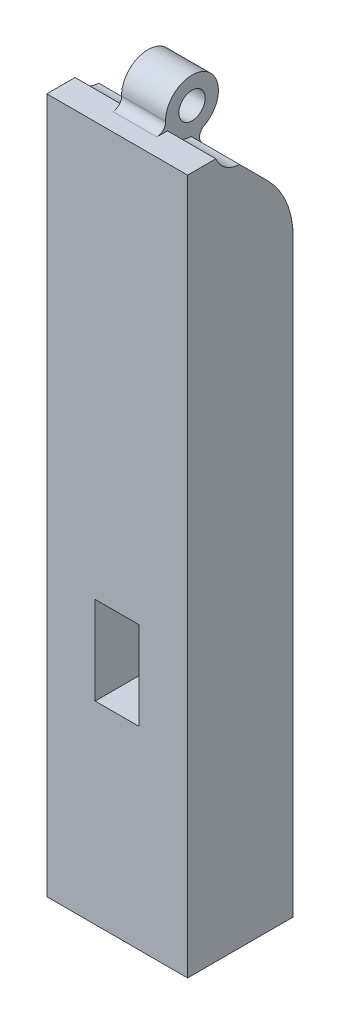
from build123d import *

# Parameters (mm, degrees)
SKETCH1_W               = 16
SKETCH1_H               = 79
BOSS_EXTRUDE1_DEPTH     = 12
CUT_EXTRUDE1_DEPTH      = 81.305666052
CUT_EXTRUDE1_DEPTH_BACK = 81.305666052
CUT_EXTRUDE2_DEPTH      = 81.305666052
CUT_EXTRUDE2_DEPTH_BACK = 81.305666052
SKETCH4_R               = 3
SKETCH4_R_2             = 1.5
BOSS_EXTRUDE2_DEPTH     = 2.5
FILLET1_R               = 1
FILLET2_R               = 10
SKETCH5_W               = 5
SKETCH5_H               = 10
CUT_EXTRUDE3_DEPTH      = 5
CUT_EXTRUDE4_REACH      = 55.096
SKETCH6_W               = 5
SKETCH6_H               = 2.5
SKETCH7_W               = 5
SKETCH7_H               = 10
CUT_EXTRUDE5_DEPTH      = 81.305666052


with BuildPart() as part:
    # Sketch1 → Boss-Extrude1 (new body)
    with BuildSketch(Plane.XY):
        with Locations((0, -39.5)):
            Rectangle(SKETCH1_W, SKETCH1_H)
    extrude(amount=BOSS_EXTRUDE1_DEPTH)

    # Sketch2 → Cut-Extrude1 (cut, two sides: drawn at the far end of the back side and taken through both)
    with BuildSketch(Plane(origin=(0, 0, 0), x_dir=(0, 0, -1), z_dir=(1, 0, 0)).offset(-CUT_EXTRUDE1_DEPTH_BACK)):
        Polygon((-8, 0), (0, 0), (0, -8), align=None)
    extrude(amount=CUT_EXTRUDE1_DEPTH + CUT_EXTRUDE1_DEPTH_BACK, mode=Mode.SUBTRACT)

    # Sketch3 → Cut-Extrude2 (cut, two sides: drawn at the far end of the back side and taken through both)
    with BuildSketch(Plane(origin=(0, 0, 0), x_dir=(0, 0, -1), z_dir=(1, 0, 0)).offset(-CUT_EXTRUDE2_DEPTH_BACK)):
        with BuildLine():
            ThreePointArc((-3, 1.1), (-6.559834153, 4.04730143), (-8.791057147, 0))
            Line((-8.791057147, 0), (-7.019803903, 0))
            ThreePointArc((-7.019803903, 0), (-6.600122548, 2.474719218), (-4.5, 1.1))
            ThreePointArc((-4.5, 1.1), (-4.625280782, 0.499877452), (-4.980196097, 0))
            Line((-4.980196097, 0), (-3.208942853, 0))
            ThreePointArc((-3.208942853, 0), (-3.05269857, 0.540165847), (-3, 1.1))
        make_face()
        with BuildLine():
            Line((-7.019803903, 0), (-8.791057147, 0))
            ThreePointArc((-8.791057147, 0), (-6, -1.9), (-3.208942853, 0))
            Line((-3.208942853, 0), (-4.980196097, 0))
            ThreePointArc((-4.980196097, 0), (-6, -0.4), (-7.019803903, 0))
        make_face()
    extrude(amount=CUT_EXTRUDE2_DEPTH + CUT_EXTRUDE2_DEPTH_BACK, mode=Mode.SUBTRACT)

    # Sketch4 → Boss-Extrude2 (add, symmetric)
    with BuildSketch(Plane(origin=(0, 0, 0), x_dir=(0, 0, -1), z_dir=(1, 0, 0))):
        with Locations((-6, 1.1)):
            Circle(SKETCH4_R)
        with Locations((-6, 1.1)):
            Circle(SKETCH4_R_2, mode=Mode.SUBTRACT)
    extrude(amount=BOSS_EXTRUDE2_DEPTH, both=True)

    # Fillet1
    fillet1_edges = [part.edges().sort_by_distance(p)[0] for p in [
        (0, -1.898274836, 6.101725164),
        (0, 0, 8.791057147),
    ]]
    fillet(fillet1_edges, radius=FILLET1_R)

    # Fillet2
    fillet2_edges = [part.edges().sort_by_distance(p)[0] for p in [
        (0, -8, 0),
    ]]
    fillet(fillet2_edges, radius=FILLET2_R)

    # Sketch5 → Cut-Extrude3 (cut)
    with BuildSketch(Plane(origin=(0, 0, 0), x_dir=(-1, 0, 0), z_dir=(0, 0, -1))):
        with Locations((0, -32)):
            Rectangle(SKETCH5_W, SKETCH5_H)
        with Locations((0, -52)):
            Rectangle(SKETCH5_W, SKETCH5_H)
    extrude(amount=-CUT_EXTRUDE3_DEPTH, mode=Mode.SUBTRACT)

    # Sketch6 → Cut-Extrude4 (cut, up to next)
    with BuildSketch(Plane.XZ.offset(47), mode=Mode.PRIVATE) as cut_extrude4_sk1:
        with Locations((0, 3.75)):
            Rectangle(SKETCH6_W, SKETCH6_H)
    cut_extrude4_tool1 = extrude(cut_extrude4_sk1.sketch, amount=-CUT_EXTRUDE4_REACH, mode=Mode.PRIVATE) & part.part
    add(cut_extrude4_tool1.solids().sort_by_distance((0, -47, 3.75))[0], mode=Mode.SUBTRACT)

    # Sketch7 → Cut-Extrude5 (cut, through all)
    with BuildSketch(Plane(origin=(0, 0, 0), x_dir=(-1, 0, 0), z_dir=(0, 0, -1))):
        with Locations((0, -52)):
            Rectangle(SKETCH7_W, SKETCH7_H)
    extrude(amount=-CUT_EXTRUDE5_DEPTH, mode=Mode.SUBTRACT)


solid = part.part
